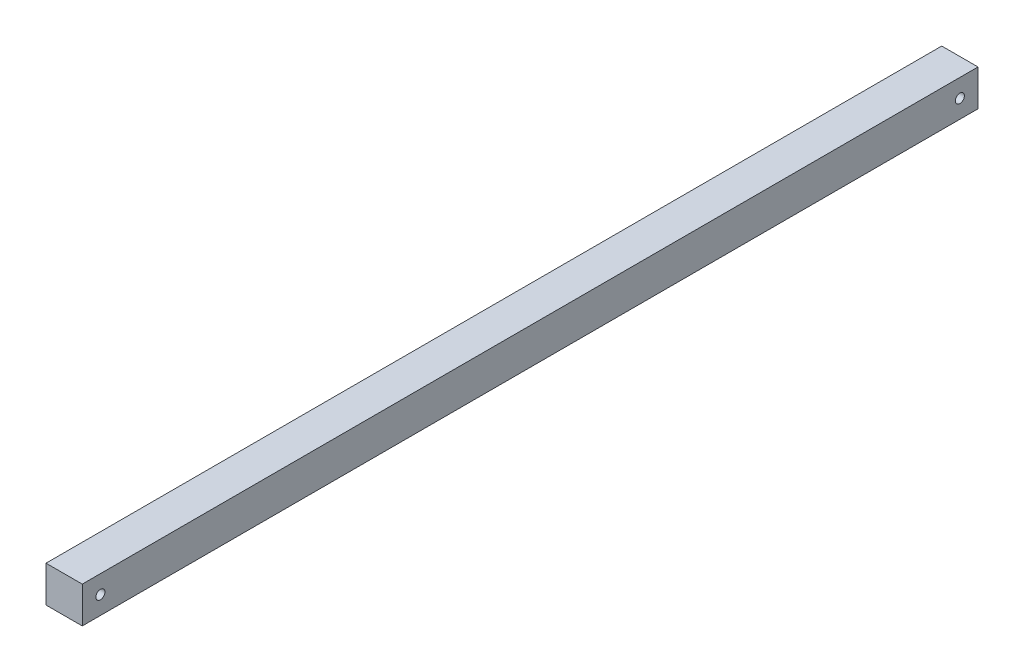
from build123d import *

# Parameters (mm, degrees)
ESQUISSE1_W           = 10
ESQUISSE1_H           = 10
BOSS_EXTRU_1_DEPTH    = 247
TROU_TARAUD_M3X0_51_D = 2.5


with BuildPart() as part:
    # Esquisse1 → Boss.-Extru.1 (new body)
    with BuildSketch(Plane.XY):
        Rectangle(ESQUISSE1_W, ESQUISSE1_H)
    extrude(amount=BOSS_EXTRU_1_DEPTH)

    # Trou taraudé M3x0.51 (through all)
    with Locations(Plane.ZY.offset(5)):
        with Locations((242, 0), (5, 0)):
            Hole(TROU_TARAUD_M3X0_51_D / 2)


solid = part.part
